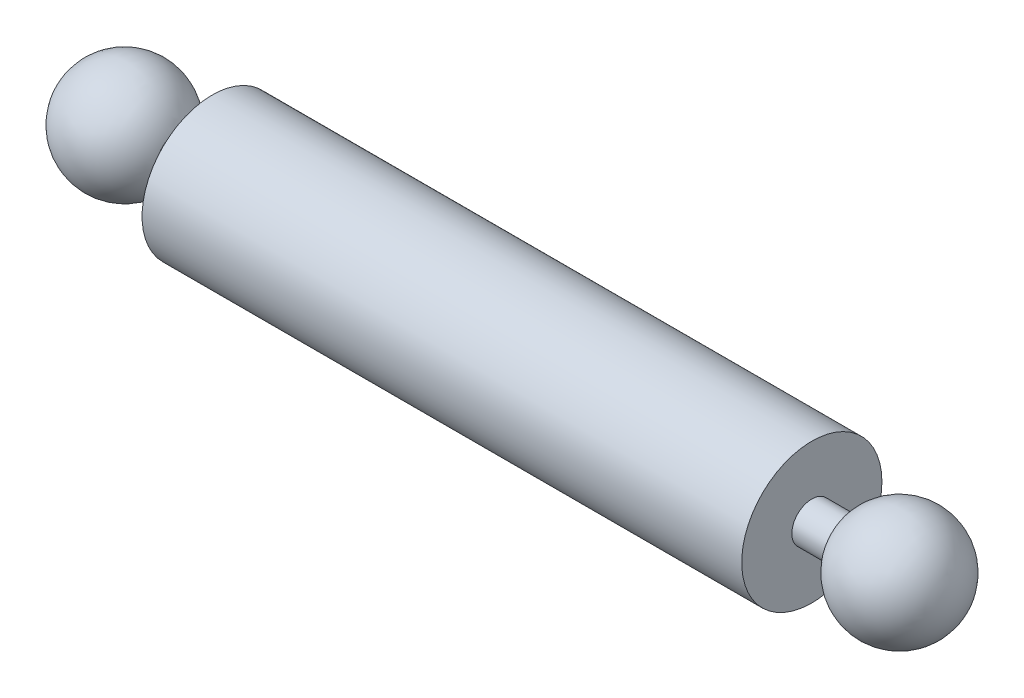
from build123d import *

# Parameters (mm, degrees)
SKETCH1_R           = 5.56895
BOSS_EXTRUDE1_DEPTH = 23.8125
SKETCH2_R           = 1.5875
BOSS_EXTRUDE2_DEPTH = 3.175


with BuildPart() as part:
    # Sketch1 → Boss-Extrude1 (new, symmetric)
    with BuildSketch(Plane(origin=(0, 0, 0), x_dir=(0, 0, -1), z_dir=(1, 0, 0))):
        Circle(SKETCH1_R)
    extrude(amount=BOSS_EXTRUDE1_DEPTH, both=True)

    # Sketch2 → Boss-Extrude2 (add)
    with BuildSketch(Plane.ZY.offset(23.8125)):
        Circle(SKETCH2_R)
    boss_extrude2 = extrude(amount=BOSS_EXTRUDE2_DEPTH)

    # Sketch5 → Revolve1 (revolve)
    with BuildSketch(Plane.XY):
        with BuildLine():
            Line((-35.1917, 0), (-26.3525, 0))
            ThreePointArc((-26.3525, 0), (-30.7721, 4.4196), (-35.1917, 0))
        make_face()
    revolve1 = revolve(axis=Axis((-35.1917, 0, 0), (1, 0, 0)))

    # Mirror2: Boss-Extrude2, Revolve1 across plane
    add(boss_extrude2.mirror(Plane(origin=(0, 0, 0), x_dir=(0, 0, 1), z_dir=(1, 0, 0))))
    add(revolve1.mirror(Plane(origin=(0, 0, 0), x_dir=(0, 0, 1), z_dir=(1, 0, 0))))


solid = part.part
